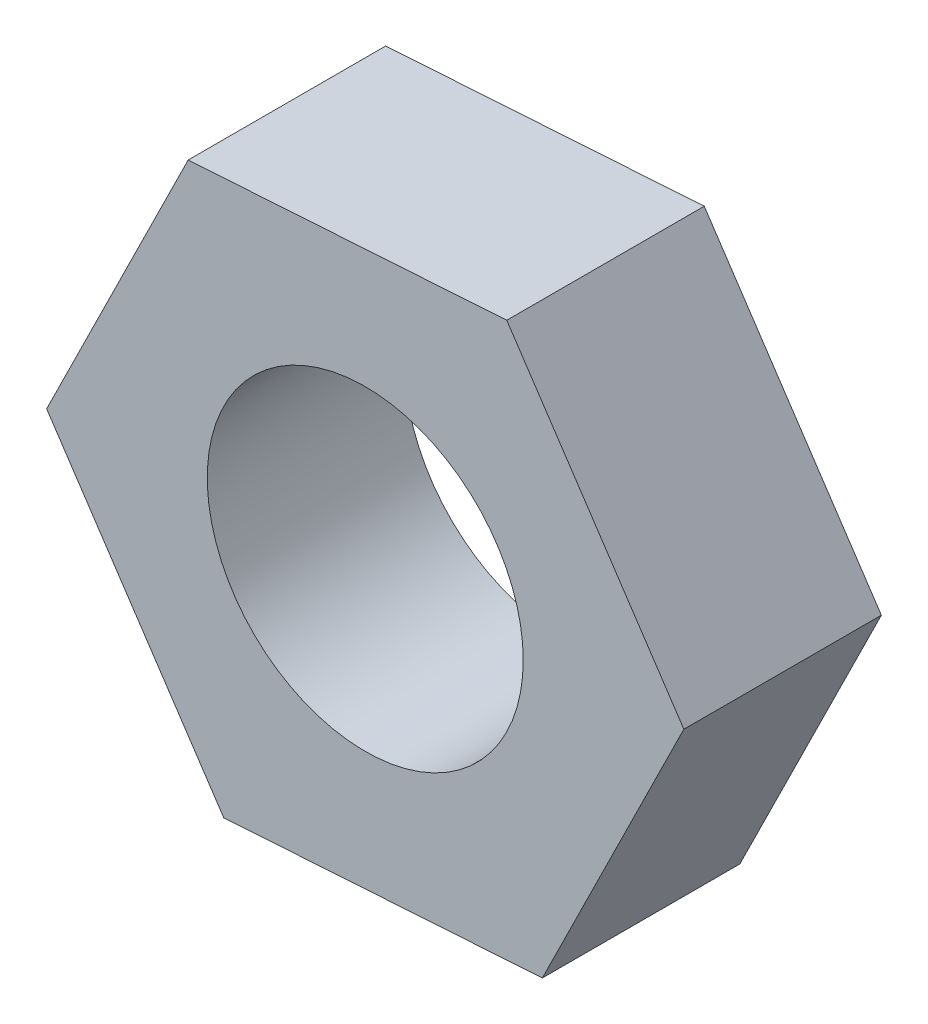
from build123d import *

# Parameters (mm, degrees)
SKETCH1_R           = 4
BOSS_EXTRUDE1_DEPTH = 2.5


with BuildPart() as part:
    # Sketch1 → Boss-Extrude1 (new, symmetric)
    with BuildSketch(Plane.XY):
        Polygon((4.483588307, -6.72538246), (8.066146214, 0.520210144), (3.582557907, 7.245592603), (-4.483588307, 6.72538246), (-8.066146214, -0.520210144), (-3.582557907, -7.245592603), align=None)
        Circle(SKETCH1_R, mode=Mode.SUBTRACT)
    extrude(amount=BOSS_EXTRUDE1_DEPTH, both=True)


solid = part.part
